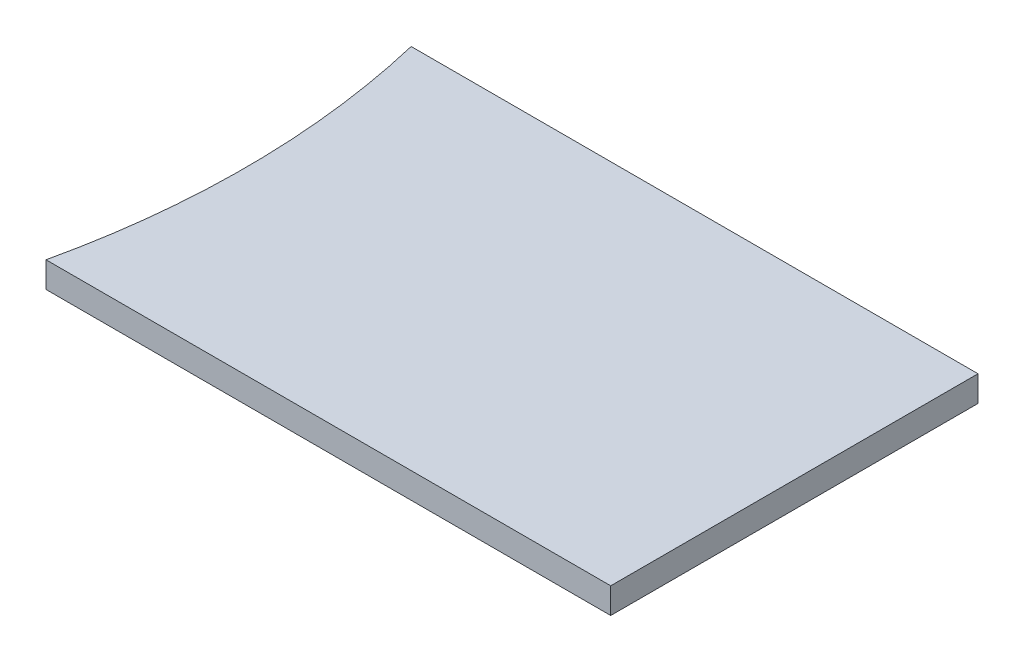
from build123d import *

# Parameters (mm, degrees)
SKETCH1_W           = 34.500380228
SKETCH1_H           = 21.4
BOSS_EXTRUDE1_DEPTH = 1.5
SKETCH2_R           = 47.3
CUT_EXTRUDE1_DEPTH  = 1.5


with BuildPart() as part:
    # Sketch1 → Boss-Extrude1 (new body)
    with BuildSketch(Plane(origin=(0, 0, 0), x_dir=(1, 0, 0), z_dir=(0, 1, 0))):
        with Locations((17.250190114, 10.7)):
            Rectangle(SKETCH1_W, SKETCH1_H)
    extrude(amount=BOSS_EXTRUDE1_DEPTH)

    # Sketch2 → Cut-Extrude1 (cut)
    with BuildSketch(Plane(origin=(0, 1.5, 0), x_dir=(1, 0, 0), z_dir=(0, 1, 0))):
        with Locations((-44.537639276, 10.433968765)):
            Circle(SKETCH2_R)
    extrude(amount=-CUT_EXTRUDE1_DEPTH, mode=Mode.SUBTRACT)


solid = part.part
